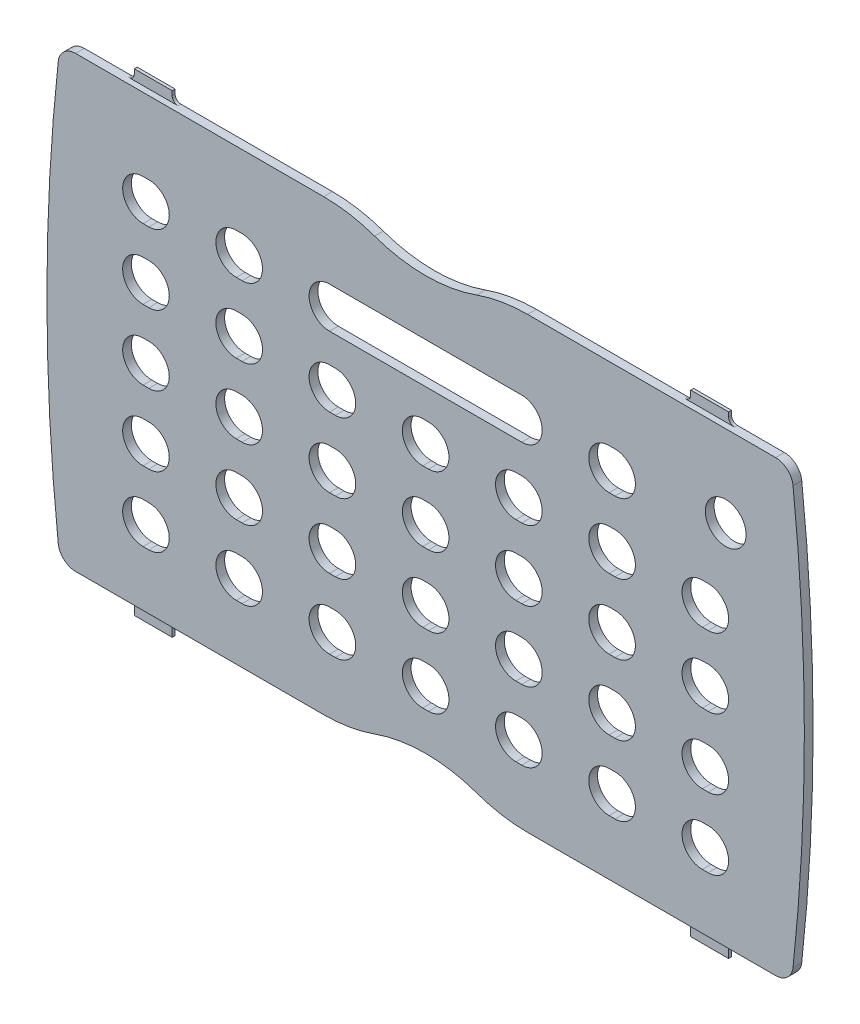
from build123d import *

# Parameters (mm, degrees)
OUTSIDE_DEPTH      = 3
CORNER_R           = 6
CUTOUT_DEPTH       = 152.122466894
CUTOUTS_COUNT      = 7
CUTOUTS_PITCH      = 32
CUTOUTS_COUNT_DIR2 = 5
CUTOUTS_PITCH_DIR2 = 24
SKETCH4_R          = 7
TOP_OPENING_DEPTH  = 152.122466894
CURVE_DEPTH        = 152.122466894
SKETCH6_W          = 62
SKETCH6_H          = 14
JOIN_DEPTH         = 152.122466894
SKETCH7_W          = 13
SKETCH7_H          = 1
TAB_DEPTH          = 5
TAB_CORNER_R       = 2
SKETCH8_W          = 13
SKETCH8_H          = 1.5
TOP_TRIM_DEPTH     = 154.71402018


with BuildPart() as part:
    # Sketch1 → Outside (new body)
    with BuildSketch(Plane.XY):
        with BuildLine():
            Line((-125.5, -77), (125.5, -77))
            ThreePointArc((125.5, -77), (130, 0), (125.5, 77))
            Line((125.5, 77), (-125.5, 77))
            ThreePointArc((-125.5, 77), (-130, 0), (-125.5, -77))
        make_face()
    extrude(amount=OUTSIDE_DEPTH)

    # Corner
    corner_edges = [part.edges().sort_by_distance(p)[0] for p in [
        (-125.5, 77, 1.5),
        (125.5, 77, 1.5),
        (125.5, -77, 1.5),
        (-125.5, -77, 1.5),
    ]]
    fillet(corner_edges, radius=CORNER_R)

    # Sketch2 → Cutout (cut, through all)
    with BuildSketch(Plane.XY.offset(3)):
        with BuildLine():
            Line((-97, -44), (-95, -44))
            ThreePointArc((-95, -44), (-88, -51), (-95, -58))
            Line((-95, -58), (-97, -58))
            ThreePointArc((-97, -58), (-104, -51), (-97, -44))
        make_face()
    cutout = extrude(amount=-CUTOUT_DEPTH, mode=Mode.SUBTRACT)

    # Cutouts: Cutout 7 × 5, 1 skipped
    with Locations(*[(i * CUTOUTS_PITCH, j * CUTOUTS_PITCH_DIR2, 0) for i in range(CUTOUTS_COUNT) for j in range(CUTOUTS_COUNT_DIR2) if (i, j) not in ((0, 0), (6, 4))]):
        add(cutout, mode=Mode.SUBTRACT)

    # Sketch4 → Top Opening (cut, through all)
    with BuildSketch(Plane.XY.offset(3)):
        with Locations((103, 49)):
            Circle(SKETCH4_R)
    extrude(amount=-TOP_OPENING_DEPTH, mode=Mode.SUBTRACT)

    # Sketch5 → Curve (cut, through all)
    with BuildSketch(Plane.XY.offset(3)):
        with BuildLine():
            Line((-35, -77), (35, -77))
            ThreePointArc((35, -77), (26.122359548, -76.244569305), (17.5, -74))
            ThreePointArc((17.5, -74), (0, -71), (-17.5, -74))
            ThreePointArc((-17.5, -74), (-26.122359548, -76.244569305), (-35, -77))
        make_face()
    curve = extrude(amount=-CURVE_DEPTH, mode=Mode.SUBTRACT)

    # Sketch6 → Join (cut, through all)
    with BuildSketch(Plane.XY.offset(3)):
        with Locations((0, 45)):
            Rectangle(SKETCH6_W, SKETCH6_H)
    extrude(amount=-JOIN_DEPTH, mode=Mode.SUBTRACT)

    # Sketch7 → Tab (add)
    with BuildSketch(Plane.XZ.offset(77)):
        with Locations((95.5, 0.5)):
            Rectangle(SKETCH7_W, SKETCH7_H)
        with Locations((-95.5, 0.5)):
            Rectangle(SKETCH7_W, SKETCH7_H)
    tab = extrude(amount=TAB_DEPTH)

    # Tabs: Curve, Tab across plane
    add(curve.mirror(Plane.ZX), mode=Mode.SUBTRACT)
    add(tab.mirror(Plane.ZX))

    # Tab Corner
    tab_corner_edges = [part.edges().sort_by_distance(p)[0] for p in [
        (89, -77, 0.5),
        (102, -77, 0.5),
        (-102, -77, 0.5),
        (-89, -77, 0.5),
        (89, 77, 0.5),
        (102, 77, 0.5),
        (-102, 77, 0.5),
        (-89, 77, 0.5),
    ]]
    fillet(tab_corner_edges, radius=TAB_CORNER_R)

    # Sketch8 → Top Trim (cut, through all)
    with BuildSketch(Plane.XY.offset(1)):
        with Locations((-95.5, 81.25)):
            Rectangle(SKETCH8_W, SKETCH8_H)
        with Locations((95.5, 81.25)):
            Rectangle(SKETCH8_W, SKETCH8_H)
    extrude(amount=-TOP_TRIM_DEPTH, mode=Mode.SUBTRACT)


solid = part.part
